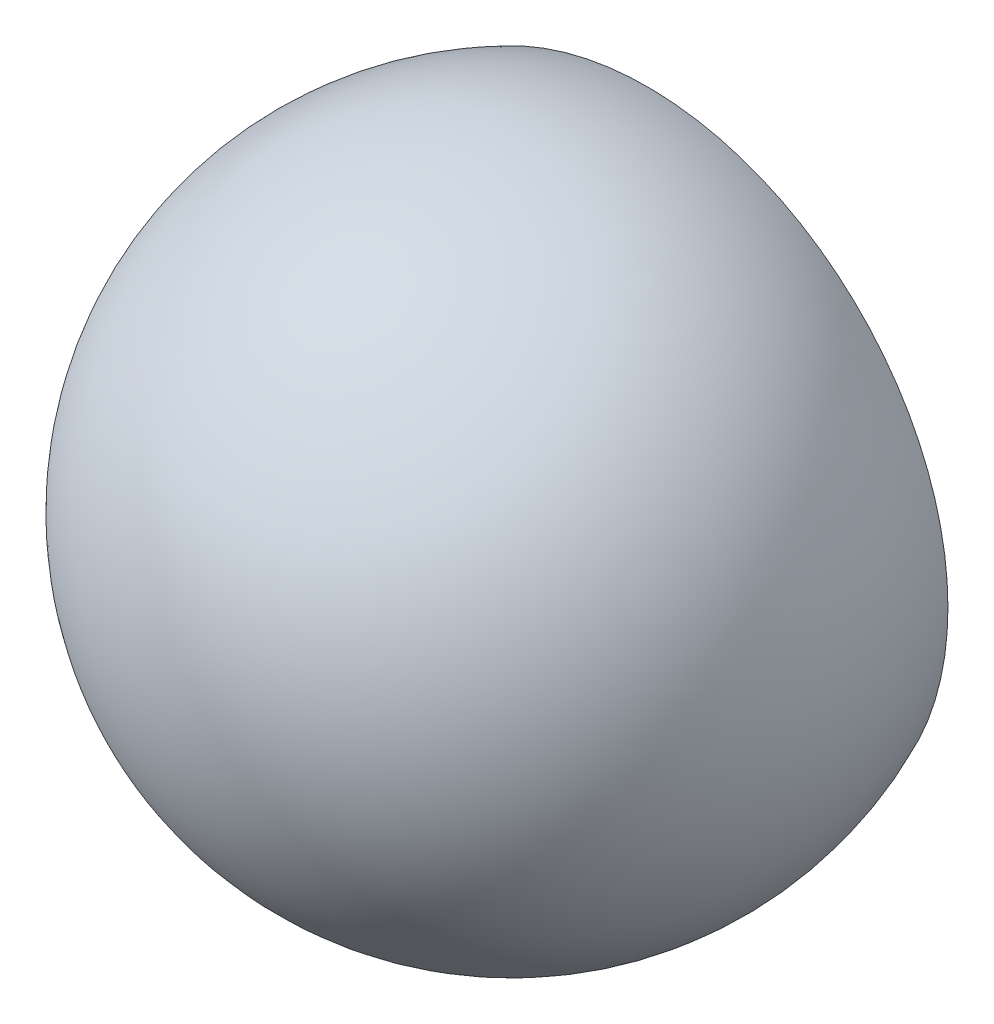
from build123d import *

# Parameters (mm, degrees)
CUT_EXTRUDE1_DEPTH      = 9.435087433
CUT_EXTRUDE1_DEPTH_BACK = 9.435087433
SKETCH2_W               = 3
SKETCH2_H               = 9.74


with BuildPart() as part:
    # Sketch1 → Revolve1 (revolve)
    with BuildSketch(Plane.XY):
        with BuildLine():
            Line((0, 4.87), (0, -4.87))
            ThreePointArc((0, -4.87), (-4.87, 0), (0, 4.87))
        make_face()
    revolve(axis=Axis((0, 4.87, 0), (0, -1, 0)))

    # Sketch2 → Cut-Extrude1 (cut, two sides: drawn at the far end of the back side and taken through both)
    with BuildSketch(Plane(origin=(0, 0, 0), x_dir=(0, 0, -1), z_dir=(1, 0, 0)).offset(-CUT_EXTRUDE1_DEPTH_BACK)):
        with Locations((3.5, 0)):
            Rectangle(SKETCH2_W, SKETCH2_H)
    extrude(amount=CUT_EXTRUDE1_DEPTH + CUT_EXTRUDE1_DEPTH_BACK, mode=Mode.SUBTRACT)


solid = part.part
